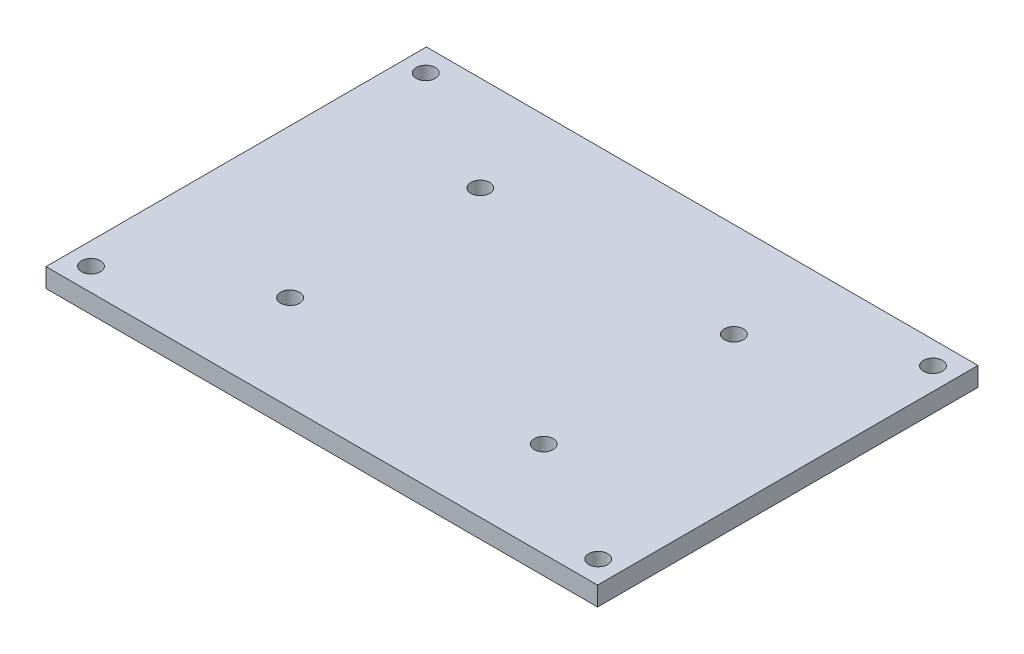
from build123d import *

# Parameters (mm, degrees)
SKETCH_1_W          = 87
SKETCH_1_H          = 60
EXTRUDE_1_DEPTH     = 3
SKETCH_2_R          = 1.5
CUT_EXTRUDE_1_DEPTH = 53.926836293
SKETCH_3_R          = 1.5
CUT_EXTRUDE_2_DEPTH = 53.926836293


with BuildPart() as part:
    # 草图1 → 凸台-拉伸1 (new body)
    with BuildSketch(Plane(origin=(0, 0, 0), x_dir=(1, 0, 0), z_dir=(0, 1, 0))):
        Rectangle(SKETCH_1_W, SKETCH_1_H)
    extrude(amount=EXTRUDE_1_DEPTH)

    # 草图2 → 切除-拉伸1 (cut, through all)
    with BuildSketch(Plane(origin=(0, 3, 0), x_dir=(1, 0, 0), z_dir=(0, 1, 0))):
        with Locations(Location((-40, 26.4, 0), (0, 0, 270))):
            Circle(SKETCH_2_R)
        with Locations(Location((40, 26.4, 0), (0, 0, 270))):
            Circle(SKETCH_2_R)
        with Locations(Location((40, -26.4, 0), (0, 0, 270))):
            Circle(SKETCH_2_R)
        with Locations(Location((-40, -26.4, 0), (0, 0, 270))):
            Circle(SKETCH_2_R)
    extrude(amount=-CUT_EXTRUDE_1_DEPTH, mode=Mode.SUBTRACT)

    # 草图3 → 切除-拉伸2 (cut, through all)
    with BuildSketch(Plane(origin=(0, 3, 0), x_dir=(1, 0, 0), z_dir=(0, 1, 0))):
        with Locations(Location((20, 15, 0), (0, 0, 270))):
            Circle(SKETCH_3_R)
        with Locations(Location((20, -15, 0), (0, 0, 270))):
            Circle(SKETCH_3_R)
        with Locations(Location((-20, 15, 0), (0, 0, 270))):
            Circle(SKETCH_3_R)
        with Locations(Location((-20, -15, 0), (0, 0, 270))):
            Circle(SKETCH_3_R)
    extrude(amount=-CUT_EXTRUDE_2_DEPTH, mode=Mode.SUBTRACT)


solid = part.part
